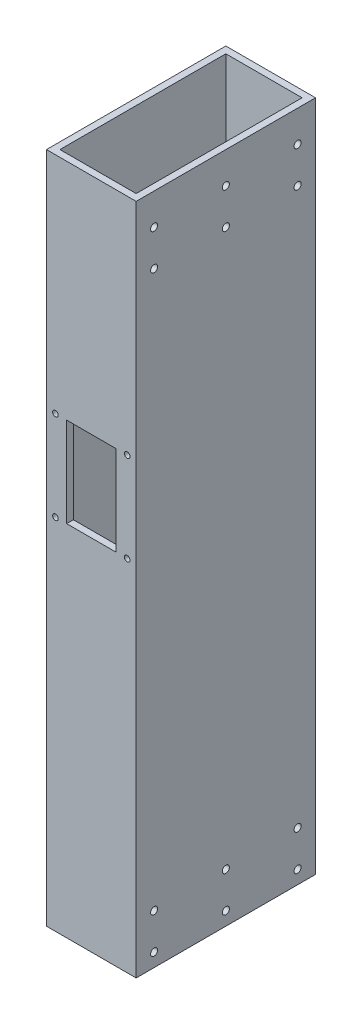
from build123d import *

# Parameters (mm, degrees)
SKETCH1_W                        = 40
SKETCH1_H                        = 80
SKETCH1_W_2                      = 34
SKETCH1_H_2                      = 74
BOSS_EXTRUDE1_DEPTH              = 300
CUT_EXTRUDE1_REACH               = 315.05
SKETCH2_W                        = 22
SKETCH2_H                        = 40
TAP_DRILL_FOR_M3_TAP1_D          = 2.5
TAP_DRILL_FOR_M3_TAP1_DEPTH      = 3
TAP_DRILL_FOR_M3_HELICOIL1_D     = 3.15
TAP_DRILL_FOR_M3_HELICOIL2_D     = 3.15
TAP_DRILL_FOR_M3_HELICOIL2_DEPTH = 3


with BuildPart() as part:
    # Sketch1 → Boss-Extrude1 (new body)
    with BuildSketch(Plane(origin=(0, 0, 0), x_dir=(1, 0, 0), z_dir=(0, 1, 0))):
        with Locations((20, 40)):
            Rectangle(SKETCH1_W, SKETCH1_H)
        with Locations((20, 40)):
            Rectangle(SKETCH1_W_2, SKETCH1_H_2, mode=Mode.SUBTRACT)
    extrude(amount=BOSS_EXTRUDE1_DEPTH)

    # Sketch2 → Cut-Extrude1 (cut, up to next)
    with BuildSketch(Plane.XY, mode=Mode.PRIVATE) as cut_extrude1_sk1:
        with Locations((20, 180)):
            Rectangle(SKETCH2_W, SKETCH2_H)
    cut_extrude1_tool1 = extrude(cut_extrude1_sk1.sketch, amount=-CUT_EXTRUDE1_REACH, mode=Mode.PRIVATE) & part.part
    add(cut_extrude1_tool1.solids().sort_by_distance((20, 180, 0))[0], mode=Mode.SUBTRACT)

    # Tap Drill for M3 Tap1
    with Locations(Plane.XY):
        with Locations((4, 200), (36, 200), (36, 160), (4, 160)):
            Hole(TAP_DRILL_FOR_M3_TAP1_D / 2, depth=TAP_DRILL_FOR_M3_TAP1_DEPTH)

    # Tap Drill for M3 Helicoil1 (through all)
    with Locations(Plane.ZY):
        with Locations((-8, 6), (-40, 6), (-72, 6), (-40, 22), (-72, 22), (-8, 22)):
            Hole(TAP_DRILL_FOR_M3_HELICOIL1_D / 2)

    # Tap Drill for M3 Helicoil2
    with Locations(Plane(origin=(40, 0, 0), x_dir=(0, 0, -1), z_dir=(1, 0, 0))):
        with Locations((72, 286), (72, 270), (40, 286), (40, 270), (8, 286), (8, 270)):
            Hole(TAP_DRILL_FOR_M3_HELICOIL2_D / 2, depth=TAP_DRILL_FOR_M3_HELICOIL2_DEPTH)


solid = part.part
